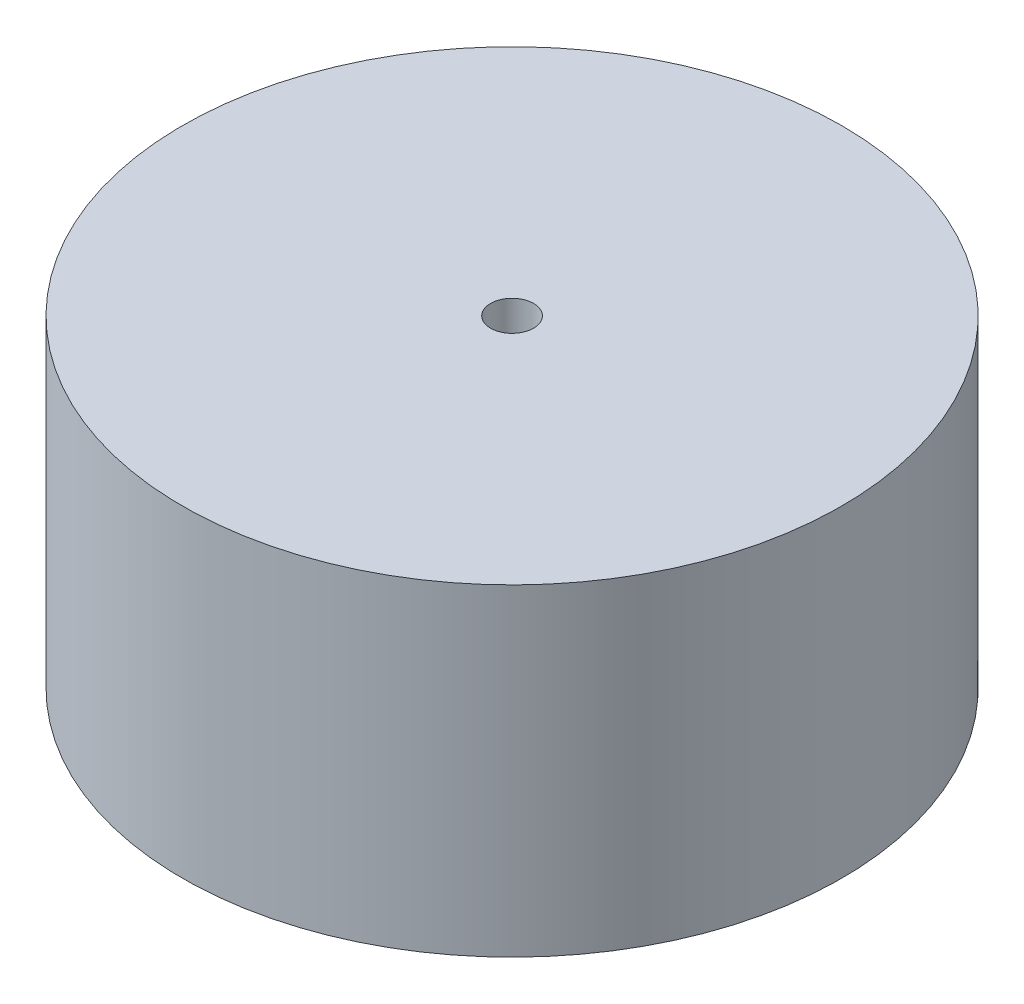
from build123d import *

# Parameters (mm, degrees)
SKETCH1_R           = 23
BOSS_EXTRUDE1_DEPTH = 22.5
SKETCH3_R           = 1.5
CUT_EXTRUDE1_DEPTH  = 64.514112944


with BuildPart() as part:
    # Sketch1 → Boss-Extrude1 (new body)
    with BuildSketch(Plane(origin=(0, 0, 0), x_dir=(1, 0, 0), z_dir=(0, 1, 0))):
        with Locations(Location((-29.725277397, 4.346620751, 0), (0, 0, 90))):
            Circle(SKETCH1_R)
    extrude(amount=BOSS_EXTRUDE1_DEPTH)

    # Sketch3 → Cut-Extrude1 (cut, through all)
    with BuildSketch(Plane.XZ):
        with Locations(Location((-29.725277397, -4.346620751, 0), (0, 0, 270))):
            Circle(SKETCH3_R)
    extrude(amount=-CUT_EXTRUDE1_DEPTH, mode=Mode.SUBTRACT)


solid = part.part
